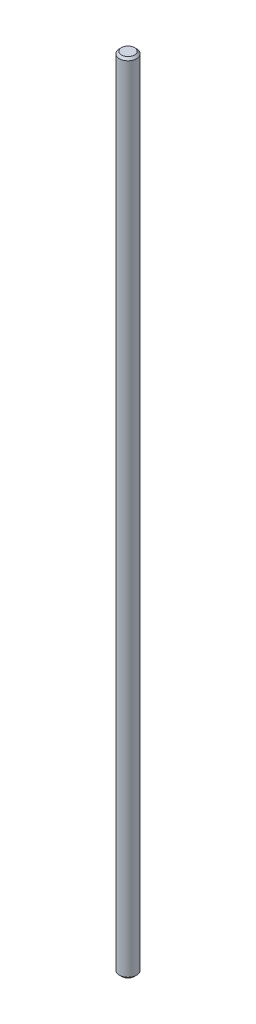
from build123d import *

# Parameters (mm, degrees)
SKETCH1_R           = 4
BOSS_EXTRUDE1_DEPTH = 370
CHAMFER1_SIZE       = 1


with BuildPart() as part:
    # Sketch1 → Boss-Extrude1 (new body)
    with BuildSketch(Plane(origin=(0, 0, 0), x_dir=(1, 0, 0), z_dir=(0, 1, 0))):
        with Locations(Location((0, 0, 0), (0, 0, 270))):
            Circle(SKETCH1_R)
    extrude(amount=BOSS_EXTRUDE1_DEPTH)

    # Chamfer1
    chamfer1_edges = [part.edges().sort_by_distance(p)[0] for p in [
        (0, 0, -4),
        (0, 370, -4),
    ]]
    chamfer(chamfer1_edges, length=CHAMFER1_SIZE)


solid = part.part
